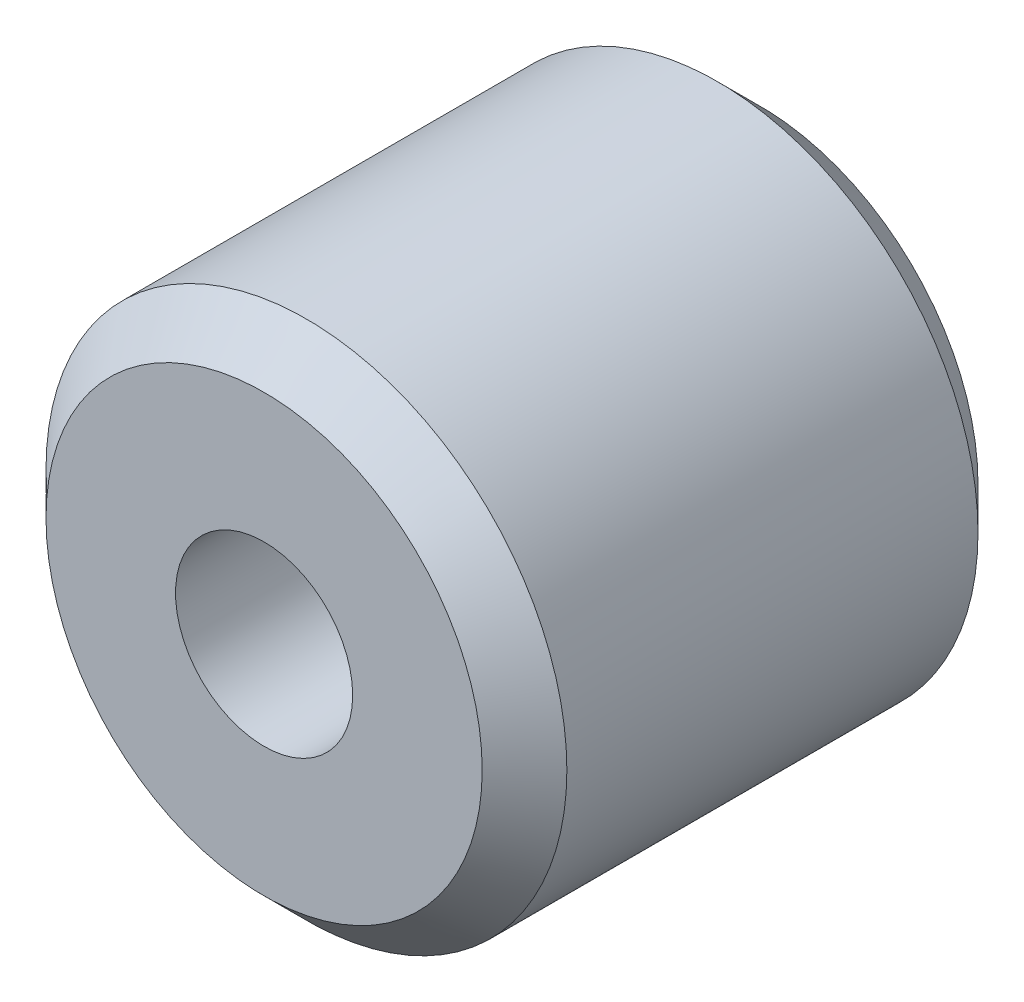
from build123d import *

# Parameters (mm, degrees)
SKETCH1_R           = 4.675
SKETCH1_R_2         = 1.59
BOSS_EXTRUDE1_DEPTH = 4.45
CHAMFER1_SIZE       = 0.76


with BuildPart() as part:
    # Sketch1 → Boss-Extrude1 (new, symmetric)
    with BuildSketch(Plane.XY):
        Circle(SKETCH1_R)
        Circle(SKETCH1_R_2, mode=Mode.SUBTRACT)
    extrude(amount=BOSS_EXTRUDE1_DEPTH, both=True)

    # Chamfer1
    chamfer1_edges = [part.edges().sort_by_distance(p)[0] for p in [
        (-4.675, 0, -4.45),
        (-4.675, 0, 4.45),
    ]]
    chamfer(chamfer1_edges, length=CHAMFER1_SIZE)


solid = part.part
